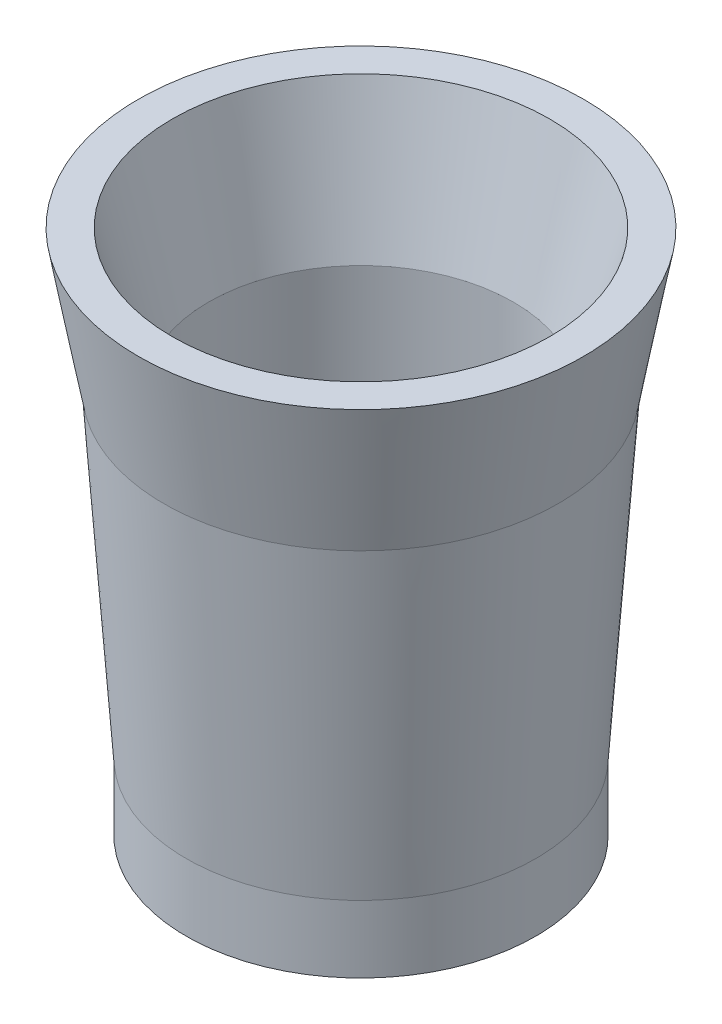
from build123d import *


with BuildPart() as part:
    # Sketch1 → Revolve1 (revolve)
    with BuildSketch(Plane.XY, mode=Mode.PRIVATE) as revolve1_sk:
        Polygon((43.18, -76.2), (36.135809999, -76.2), (43.18, -109.340308374), (49.53, -109.340308374), (49.53, -90.290308374), (55.88, 0), (63.1204351, 39.7879841), (53.469872334, 39.7879841), (43.18, 0), align=None)
    revolve(revolve1_sk.sketch.rotate(Axis((0, -120.416222998, 0), (0, 1, 0)), 90), axis=Axis((0, -120.416222998, 0), (0, 1, 0)))


solid = part.part
